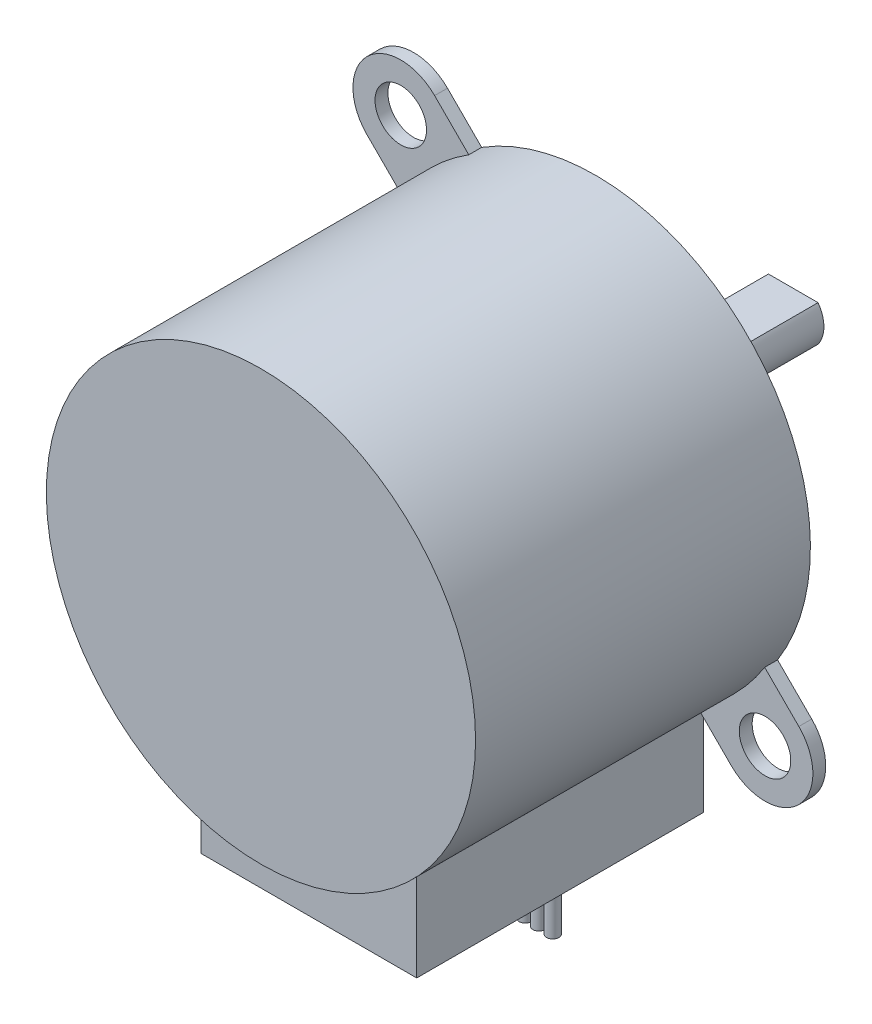
from build123d import *

# Parameters (mm, degrees)
SKETCH_1_R          = 17.5
EXTRUDE_1_DEPTH     = 27.3
SKETCH_2_R          = 4.85
EXTRUDE_2_DEPTH     = 2.5
SKETCH_3_R          = 2.5
EXTRUDE_3_DEPTH     = 4.6
EXTRUDE_4_DEPTH     = 9
EXTRUDE_5_DEPTH     = 23.4
SKETCH_6_R          = 2.1
EXTRUDE_6_DEPTH     = 1.05
CUT_EXTRUDE_1_DEPTH = 1.05
SKETCH_8_R          = 0.5
EXTRUDE_7_DEPTH     = 10


with BuildPart() as part:
    # 草图1 → 凸台-拉伸1 (new body)
    with BuildSketch(Plane.XY):
        Circle(SKETCH_1_R)
    extrude(amount=EXTRUDE_1_DEPTH)

    # 草图2 → 凸台-拉伸2 (add)
    with BuildSketch(Plane(origin=(0, 0, 0), x_dir=(-1, 0, 0), z_dir=(0, 0, -1))):
        Circle(SKETCH_2_R)
    extrude(amount=EXTRUDE_2_DEPTH)

    # 草图3 → 凸台-拉伸3 (add)
    with BuildSketch(Plane(origin=(0, 0, -2.5), x_dir=(-1, 0, 0), z_dir=(0, 0, -1))):
        Circle(SKETCH_3_R)
    extrude(amount=EXTRUDE_3_DEPTH)

    # 草图4 → 凸台-拉伸4 (add)
    with BuildSketch(Plane(origin=(0, 0, -7.1), x_dir=(-1, 0, 0), z_dir=(0, 0, -1))):
        with BuildLine():
            Line((2.022152319, 1.47), (-2.022152319, 1.47))
            ThreePointArc((-2.022152319, 1.47), (-2.5, 0), (-2.022152319, -1.47))
            Line((-2.022152319, -1.47), (2.022152319, -1.47))
            ThreePointArc((2.022152319, -1.47), (2.377538727, -0.772858073), (2.5, 0))
            ThreePointArc((2.5, 0), (2.377538727, 0.772858073), (2.022152319, 1.47))
        make_face()
    extrude(amount=EXTRUDE_4_DEPTH)

    # 草图5 → 凸台-拉伸5 (add)
    with BuildSketch(Plane(origin=(0, 0, 0), x_dir=(-1, 0, 0), z_dir=(0, 0, -1))):
        with BuildLine():
            ThreePointArc((8.8, -15.126466871), (0, -17.5), (-8.8, -15.126466871))
            Line((-8.8, -15.126466871), (-8.8, -23.08))
            Line((-8.8, -23.08), (8.8, -23.08))
            Line((8.8, -23.08), (8.8, -15.126466871))
        make_face()
    extrude(amount=-EXTRUDE_5_DEPTH)

    # 草图6 → 凸台-拉伸6 (add)
    # profile 1 of 6: a face of its own
    with BuildSketch(Plane(origin=(0, 0, 0), x_dir=(-1, 0, 0), z_dir=(0, 0, -1))):
        with BuildLine():
            ThreePointArc((-13.433971222, -11.215097736), (-15.650847937, -11.032512316), (-17.606958852, -12.091525958))
            ThreePointArc((-17.606958852, -12.091525958), (-17.606958852, -17.606958852), (-12.091525958, -17.606958852))
            ThreePointArc((-12.091525958, -17.606958852), (-11.246112228, -16.341707791), (-10.949242405, -14.849242405))
            ThreePointArc((-10.949242405, -14.849242405), (-11.016282438, -14.129229978), (-11.215097736, -13.433971222))
            ThreePointArc((-11.215097736, -13.433971222), (-12.374368671, -12.374368671), (-13.433971222, -11.215097736))
        make_face()
        with Locations((-14.849242405, -14.849242405)):
            Circle(SKETCH_6_R, mode=Mode.SUBTRACT)
    # profile 2 of 6: a face of its own
    with BuildSketch(Plane(origin=(0, 0, 0), x_dir=(-1, 0, 0), z_dir=(0, 0, -1))):
        with BuildLine():
            ThreePointArc((-10.949242405, -14.849242405), (-11.246112228, -16.341707791), (-12.091525958, -17.606958852))
            Line((-12.091525958, -17.606958852), (-9.305450633, -14.820883527))
            ThreePointArc((-9.305450633, -14.820883527), (-10.283681626, -14.159657207), (-11.215097736, -13.433971222))
            ThreePointArc((-11.215097736, -13.433971222), (-11.016282438, -14.129229978), (-10.949242405, -14.849242405))
        make_face()
    # profile 3 of 6: a face of its own
    with BuildSketch(Plane(origin=(0, 0, 0), x_dir=(-1, 0, 0), z_dir=(0, 0, -1))):
        with BuildLine():
            ThreePointArc((-13.433971222, -11.215097736), (-14.159657207, -10.283681626), (-14.820883527, -9.305450633))
            Line((-14.820883527, -9.305450633), (-17.606958852, -12.091525958))
            ThreePointArc((-17.606958852, -12.091525958), (-15.650847937, -11.032512316), (-13.433971222, -11.215097736))
        make_face()
    # profile 4 of 6: a face of its own
    with BuildSketch(Plane(origin=(0, 0, 0), x_dir=(-1, 0, 0), z_dir=(0, 0, -1))):
        with BuildLine():
            ThreePointArc((18.749242405, 14.849242405), (16.341707791, 18.452372582), (12.091525958, 17.606958852))
            ThreePointArc((12.091525958, 17.606958852), (11.032512316, 15.650847937), (11.215097736, 13.433971222))
            ThreePointArc((11.215097736, 13.433971222), (12.374368671, 12.374368671), (13.433971222, 11.215097736))
            ThreePointArc((13.433971222, 11.215097736), (15.650847937, 11.032512316), (17.606958852, 12.091525958))
            ThreePointArc((17.606958852, 12.091525958), (18.452372582, 13.356777019), (18.749242405, 14.849242405))
        make_face()
        with Locations((14.849242405, 14.849242405)):
            Circle(SKETCH_6_R, mode=Mode.SUBTRACT)
    # profile 5 of 6: a face of its own
    with BuildSketch(Plane(origin=(0, 0, 0), x_dir=(-1, 0, 0), z_dir=(0, 0, -1))):
        with BuildLine():
            ThreePointArc((17.606958852, 12.091525958), (15.650847937, 11.032512316), (13.433971222, 11.215097736))
            ThreePointArc((13.433971222, 11.215097736), (14.159657207, 10.283681626), (14.820883527, 9.305450633))
            Line((14.820883527, 9.305450633), (17.606958852, 12.091525958))
        make_face()
    # profile 6 of 6: a face of its own
    with BuildSketch(Plane(origin=(0, 0, 0), x_dir=(-1, 0, 0), z_dir=(0, 0, -1))):
        with BuildLine():
            Line((12.091525958, 17.606958852), (9.305450633, 14.820883527))
            ThreePointArc((9.305450633, 14.820883527), (10.283681626, 14.159657207), (11.215097736, 13.433971222))
            ThreePointArc((11.215097736, 13.433971222), (11.032512316, 15.650847937), (12.091525958, 17.606958852))
        make_face()
    extrude(amount=-EXTRUDE_6_DEPTH)

    # 草图7 → 切除-拉伸1 (cut)
    with BuildSketch(Plane.XZ.offset(23.08)):
        with BuildLine():
            Line((-2, 6.6), (2, 6.6))
            ThreePointArc((2, 6.6), (2.8, 5.8), (2, 5))
            Line((2, 5), (-2, 5))
            ThreePointArc((-2, 5), (-2.8, 5.8), (-2, 6.6))
        make_face()
    extrude(amount=-CUT_EXTRUDE_1_DEPTH, mode=Mode.SUBTRACT)

    # 草图8 → 凸台-拉伸7 (add)
    with BuildSketch(Plane.XZ.offset(22.03)):
        with Locations(Location((2.287967864, 5.8, 0), (0, 0, 270))):
            Circle(SKETCH_8_R)
        with Locations(Location((1.167967864, 5.8, 0), (0, 0, 270))):
            Circle(SKETCH_8_R)
        with Locations(Location((0.047967864, 5.8, 0), (0, 0, 270))):
            Circle(SKETCH_8_R)
        with Locations(Location((-1.072032136, 5.8, 0), (0, 0, 270))):
            Circle(SKETCH_8_R)
        with Locations(Location((-2.192032136, 5.8, 0), (0, 0, 270))):
            Circle(SKETCH_8_R)
    extrude(amount=EXTRUDE_7_DEPTH)


solid = part.part
